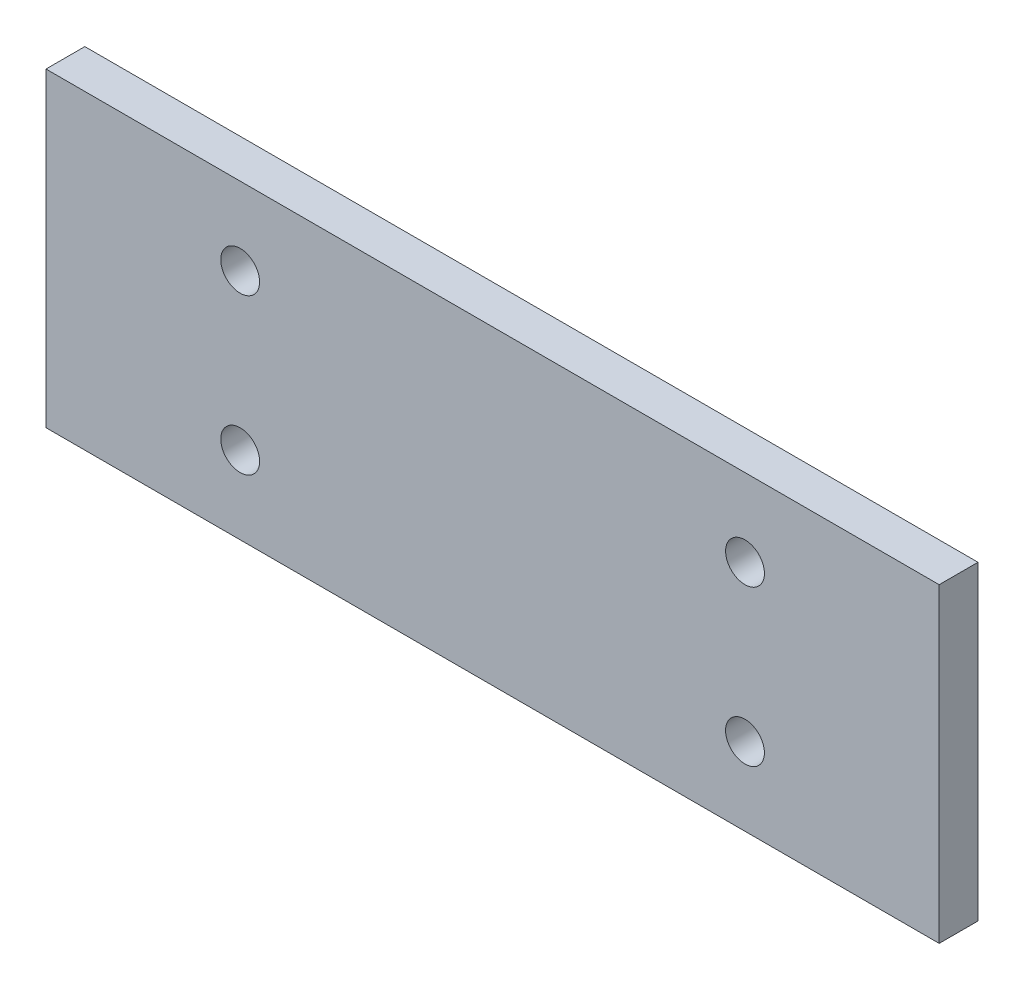
from build123d import *

# Parameters (mm, degrees)
SKETCH1_W           = 115
SKETCH1_H           = 40
SKETCH1_R           = 2.5
BOSS_EXTRUDE1_DEPTH = 5


with BuildPart() as part:
    # Sketch1 → Boss-Extrude1 (new body)
    with BuildSketch(Plane.XY):
        Rectangle(SKETCH1_W, SKETCH1_H)
        with Locations((-32.5, 10)):
            Circle(SKETCH1_R, mode=Mode.SUBTRACT)
        with Locations((32.5, 10)):
            Circle(SKETCH1_R, mode=Mode.SUBTRACT)
        with Locations(Location((32.5, -10, 0), (0, 0, 180))):
            Circle(SKETCH1_R, mode=Mode.SUBTRACT)
        with Locations(Location((-32.5, -10, 0), (0, 0, 180))):
            Circle(SKETCH1_R, mode=Mode.SUBTRACT)
    extrude(amount=BOSS_EXTRUDE1_DEPTH)


solid = part.part
